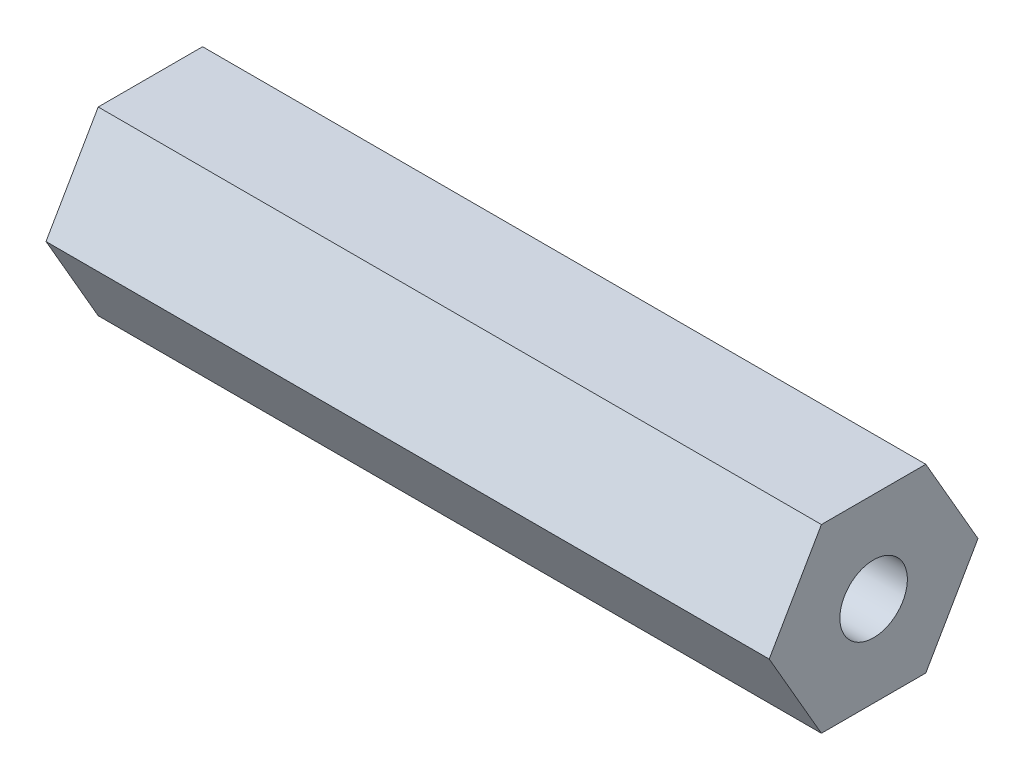
from build123d import *

# Parameters (mm, degrees)
BOSS_EXTRUDE1_DEPTH   = 19.05
F_2_56_TAPPED_HOLE1_D = 1.778


with BuildPart() as part:
    # Sketch1 → Boss-Extrude1 (new body)
    with BuildSketch(Plane(origin=(0, 0, 0), x_dir=(0, 0, -1), z_dir=(1, 0, 0))):
        Polygon((-1.374815329, -2.38125), (1.374815329, -2.38125), (2.749630657, 0), (1.374815329, 2.38125), (-1.374815329, 2.38125), (-2.749630657, 0), align=None)
    extrude(amount=BOSS_EXTRUDE1_DEPTH)

    # #2-56 Tapped Hole1 (through all)
    with Locations(Plane.ZY):
        with Locations((0, 0)):
            Hole(F_2_56_TAPPED_HOLE1_D / 2)


solid = part.part
